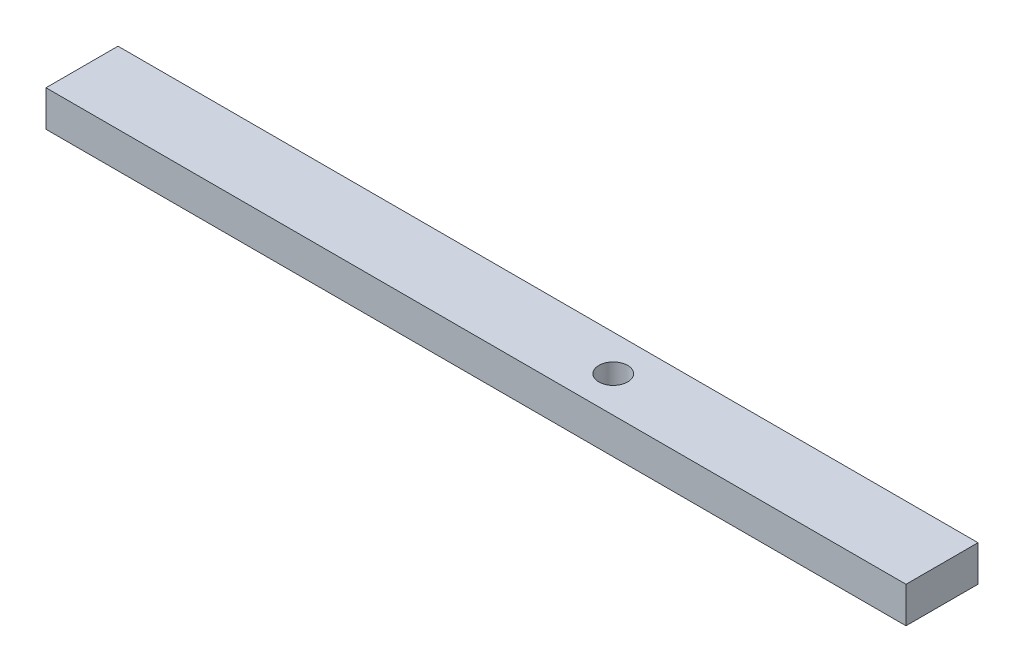
from build123d import *

# Parameters (mm, degrees)
SKETCH1_W           = 119.448982354
SKETCH1_H           = 10
SKETCH1_R           = 2
BOSS_EXTRUDE1_DEPTH = 5


with BuildPart() as part:
    # Sketch1 → Boss-Extrude1 (new body)
    with BuildSketch(Plane(origin=(0, 0, 0), x_dir=(1, 0, 0), z_dir=(0, 1, 0))):
        with Locations((-59.724491177, 5)):
            Rectangle(SKETCH1_W, SKETCH1_H)
        with Locations(Location((-45.661412325, 5, 0), (0, 0, 270))):
            Circle(SKETCH1_R, mode=Mode.SUBTRACT)
    extrude(amount=BOSS_EXTRUDE1_DEPTH)


solid = part.part
